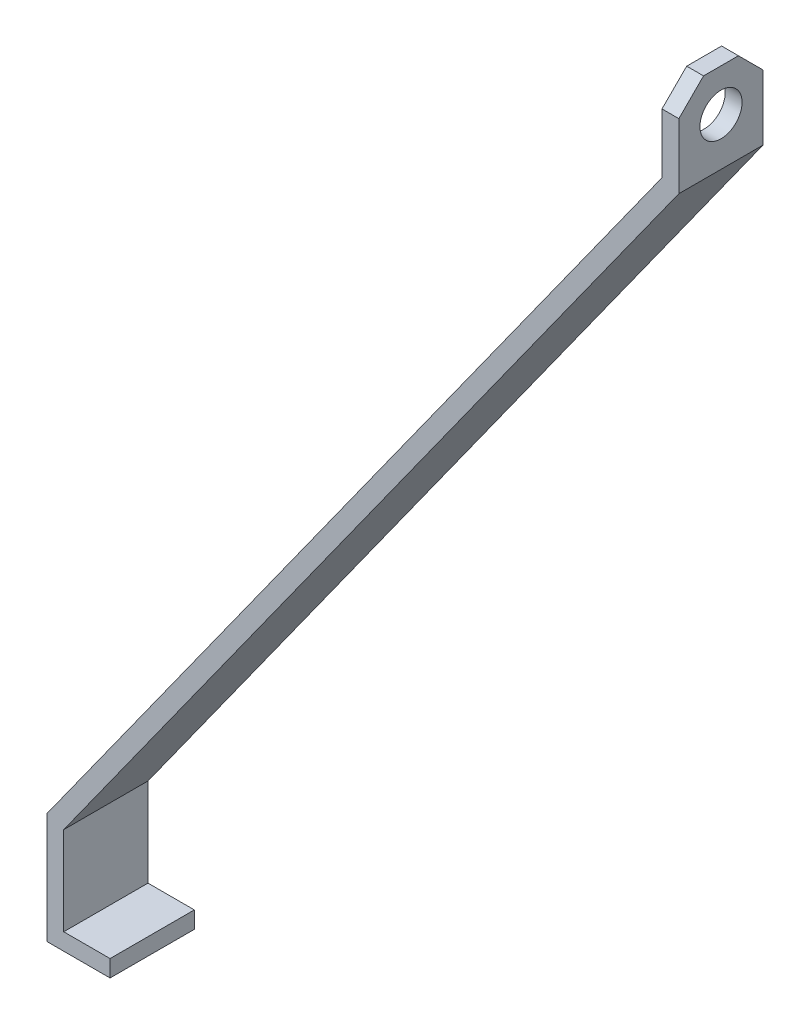
from build123d import *

# Parameters (mm, degrees)
BOSS_EXTRUDE1_DEPTH = 8
SKETCH2_R           = 2
CUT_EXTRUDE1_DEPTH  = 117.079972433


with BuildPart() as part:
    # Sketch1 → Boss-Extrude1 (new body)
    with BuildSketch(Plane.XY):
        Polygon((0, 0), (0, -8), (-58.4, -89.485853422), (-58.4, -100), (-52.4, -100), (-52.4, -98.4), (-56.8, -98.4), (-56.8, -90), (1.6, -8.514146578), (1.6, 0), align=None)
    extrude(amount=BOSS_EXTRUDE1_DEPTH)

    # Sketch2 → Cut-Extrude1 (cut, through all)
    with BuildSketch(Plane.ZY):
        with Locations(Location((4, -4, 0), (0, 0, 270))):
            Circle(SKETCH2_R)
        Polygon((0, 0), (0, -2.343145751), (2.343145751, 0), align=None)
        Polygon((8, -2.343145751), (5.656854249, 0), (8, 0), align=None)
    extrude(amount=-CUT_EXTRUDE1_DEPTH, mode=Mode.SUBTRACT)


solid = part.part
